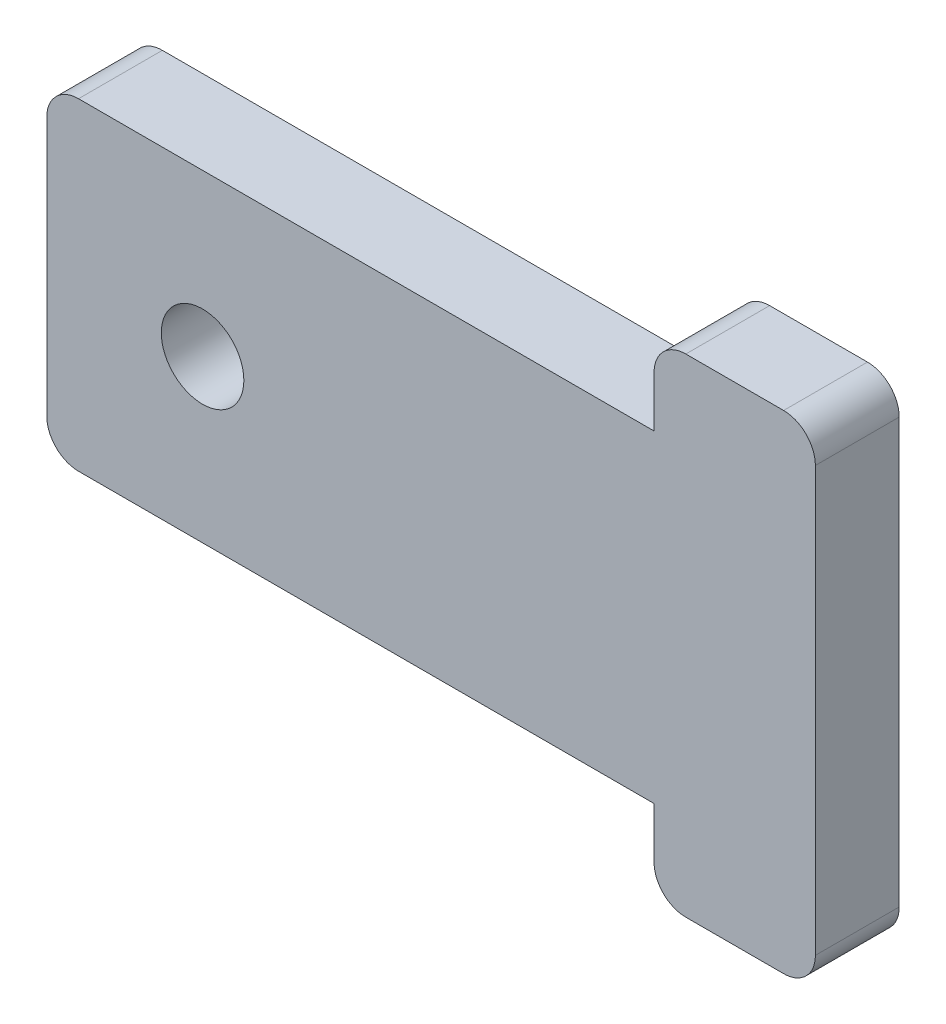
from build123d import *

# Parameters (mm, degrees)
MODEL_R             = 3.25
BOSS_EXTRUDE1_DEPTH = 6.6


with BuildPart() as part:
    # Model → Boss-Extrude1 (new body)
    with BuildSketch(Plane.XY):
        with BuildLine():
            Line((58.01, 31.9), (50.31, 31.9))
            ThreePointArc((50.31, 31.9), (48.542233047, 31.167766953), (47.81, 29.4))
            Line((47.81, 29.4), (47.81, 25.4))
            Line((47.81, 25.4), (2.5, 25.4))
            ThreePointArc((2.5, 25.4), (0.732233047, 24.667766953), (0, 22.9))
            Line((0, 22.9), (0, 2.5))
            ThreePointArc((0, 2.5), (0.732233047, 0.732233047), (2.5, 0))
            Line((2.5, 0), (47.81, 0))
            Line((47.81, 0), (47.81, -4))
            ThreePointArc((47.81, -4), (48.542233047, -5.767766953), (50.31, -6.5))
            Line((50.31, -6.5), (58.01, -6.5))
            ThreePointArc((58.01, -6.5), (59.777766953, -5.767766953), (60.51, -4))
            Line((60.51, -4), (60.51, 29.4))
            ThreePointArc((60.51, 29.4), (59.777766953, 31.167766953), (58.01, 31.9))
        make_face()
        with Locations((12.264807358, 12.7)):
            Circle(MODEL_R, mode=Mode.SUBTRACT)
    extrude(amount=BOSS_EXTRUDE1_DEPTH)


solid = part.part
